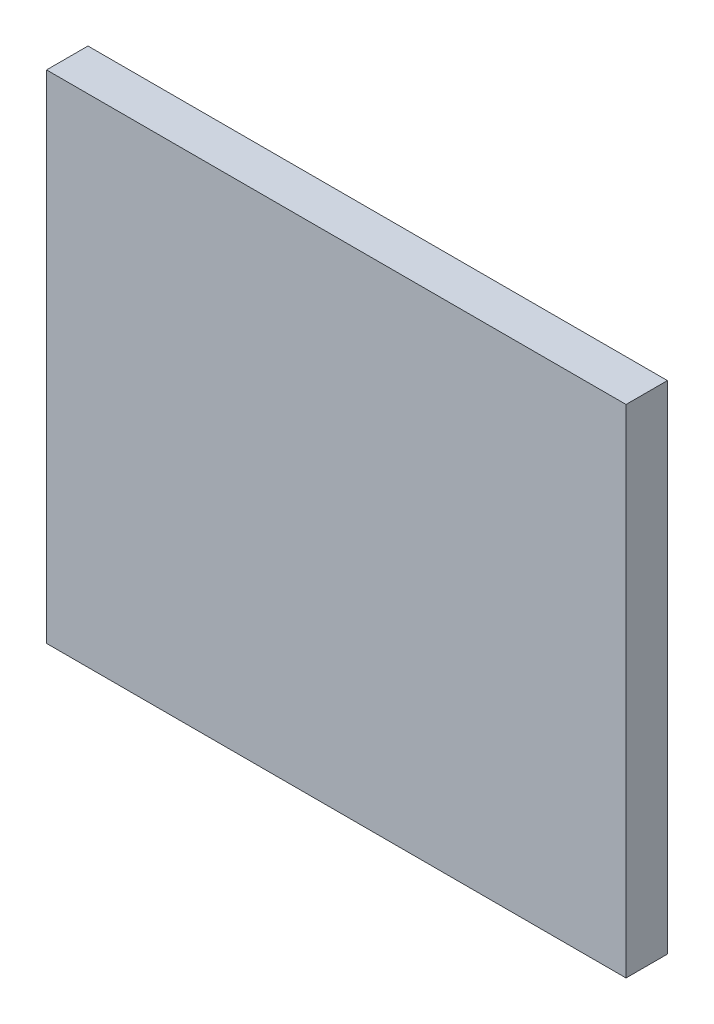
from build123d import *

# Parameters (mm, degrees)
SKETCH1_W           = 88.9
SKETCH1_H           = 76.2
BOSS_EXTRUDE1_DEPTH = 6.35


with BuildPart() as part:
    # Sketch1 → Boss-Extrude1 (new body)
    with BuildSketch(Plane.XY):
        with Locations((44.45, 38.1)):
            Rectangle(SKETCH1_W, SKETCH1_H)
    extrude(amount=BOSS_EXTRUDE1_DEPTH)


solid = part.part
